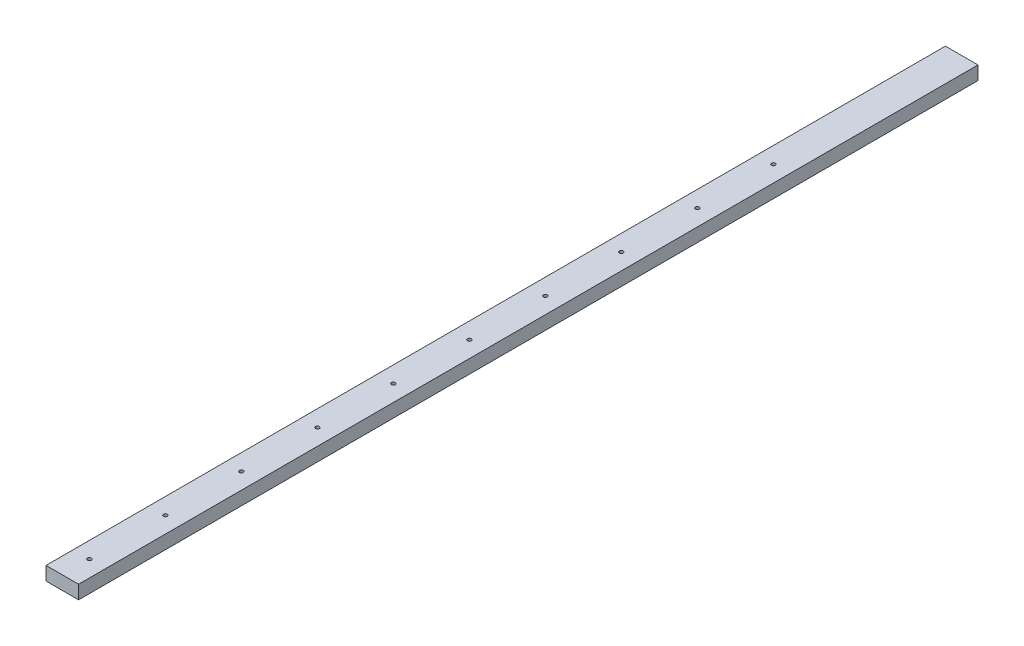
from build123d import *

# Parameters (mm, degrees)
SKETCH_1_W               = 60
SKETCH_1_H               = 25
EXTRUDE_1_DEPTH          = 1657
SKETCH_2_R               = 15
CUT_EXTRUDE_1_DEPTH      = 10
CUT_EXTRUDE_2_DEPTH      = 1658.460105101
CUT_EXTRUDE_2_DEPTH_BACK = 1658.460105101
SKETCH_3_R               = 3.5


with BuildPart() as part:
    # Эскиз1 → Бобышка-Вытянуть1 (new body)
    with BuildSketch(Plane.XY):
        Rectangle(SKETCH_1_W, SKETCH_1_H)
    extrude(amount=EXTRUDE_1_DEPTH)

    # Эскиз2 → Вырез-Вытянуть1 (cut)
    with BuildSketch(Plane.XZ.offset(12.5)):
        with Locations(Location((-5, 72, 0), (0, 0, 270))):
            Circle(SKETCH_2_R)
    extrude(amount=-CUT_EXTRUDE_1_DEPTH, mode=Mode.SUBTRACT)

    # Эскиз3 → Вырез-Вытянуть2 (cut, two sides: drawn at the far end of the back side and taken through both)
    with BuildSketch(Plane(origin=(0, 12.5, 0), x_dir=(1, 0, 0), z_dir=(0, 1, 0)).offset(-CUT_EXTRUDE_2_DEPTH_BACK)):
        with Locations(Location((0, -1607, 0), (0, 0, 270))):
            Circle(SKETCH_3_R)
        with Locations(Location((0, -1467, 0), (0, 0, 270))):
            Circle(SKETCH_3_R)
        with Locations(Location((0, -1327, 0), (0, 0, 270))):
            Circle(SKETCH_3_R)
        with Locations(Location((0, -1187, 0), (0, 0, 270))):
            Circle(SKETCH_3_R)
        with Locations(Location((0, -1047, 0), (0, 0, 270))):
            Circle(SKETCH_3_R)
        with Locations(Location((0, -907, 0), (0, 0, 270))):
            Circle(SKETCH_3_R)
        with Locations(Location((0, -767, 0), (0, 0, 270))):
            Circle(SKETCH_3_R)
        with Locations(Location((0, -627, 0), (0, 0, 270))):
            Circle(SKETCH_3_R)
        with Locations(Location((0, -487, 0), (0, 0, 270))):
            Circle(SKETCH_3_R)
        with Locations(Location((0, -347, 0), (0, 0, 270))):
            Circle(SKETCH_3_R)
    extrude(amount=CUT_EXTRUDE_2_DEPTH + CUT_EXTRUDE_2_DEPTH_BACK, mode=Mode.SUBTRACT)


solid = part.part
